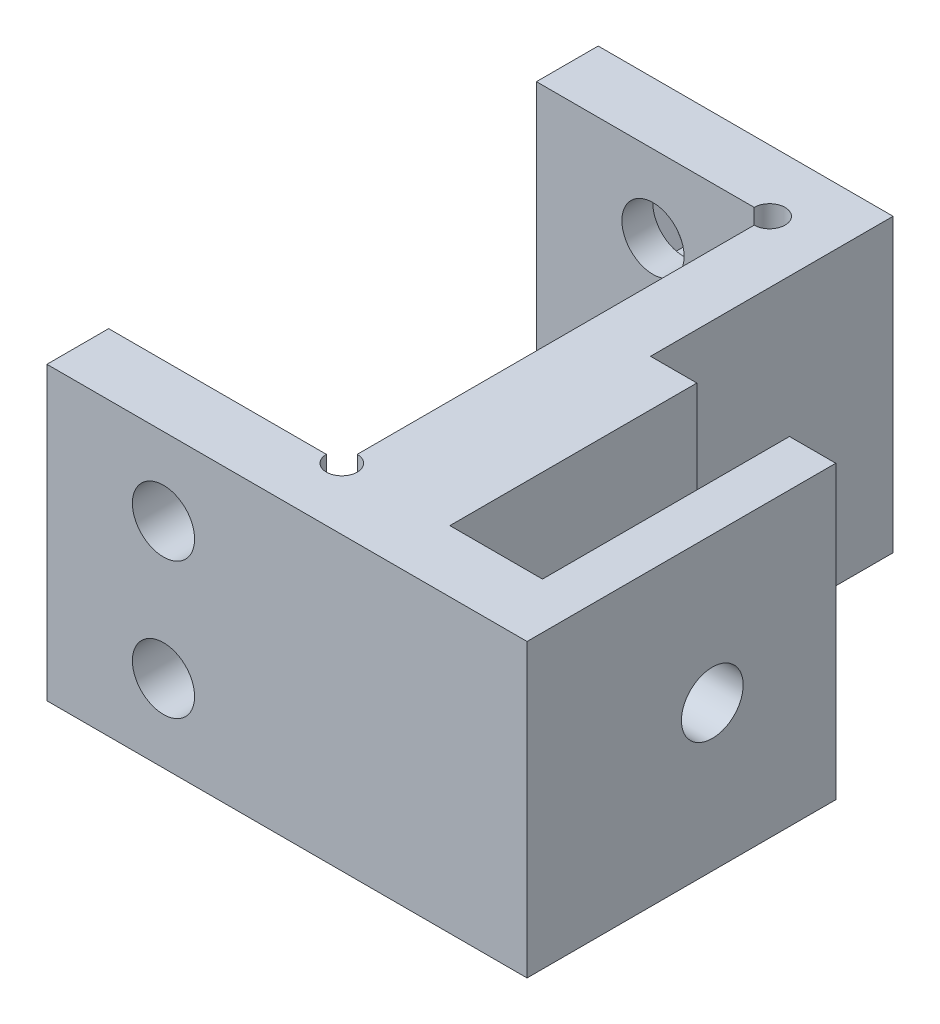
from build123d import *

# Parameters (mm, degrees)
SKETCH1_W               = 11.9888
SKETCH1_H               = 14.986
BOSS_EXTRUDE1_DEPTH     = 3.175
SKETCH6_W               = 25.1714
SKETCH6_H               = 14.986
BOSS_EXTRUDE6_DEPTH     = 3.175
SKETCH10_W              = 24.6888
SKETCH10_H              = 14.986
BOSS_EXTRUDE7_DEPTH     = 3.175
M3_CLEARANCE_HOLE1_D    = 3.2
SKETCH15_R              = 0.79375
CUT_EXTRUDE5_DEPTH      = 41.467708539
CUT_EXTRUDE6_DEPTH      = 1.5875
SKETCH17_W              = 9.525
SKETCH17_H              = 14.986
BOSS_EXTRUDE8_DEPTH     = 12.7
CUT_EXTRUDE7_DEPTH      = 2.38125
CUT_EXTRUDE7_DEPTH_BACK = 2.38125
SKETCH19_W              = 12.7
SKETCH19_H              = 14.986
SKETCH20_R              = 1.5875
CUT_EXTRUDE8_DEPTH      = 16.60525
CUT_EXTRUDE9_DEPTH      = 3.39725


with BuildPart() as part:
    # Sketch1 → Boss-Extrude1 (new body)
    with BuildSketch(Plane.XY):
        with Locations((5.9944, 7.493)):
            Rectangle(SKETCH1_W, SKETCH1_H)
    extrude(amount=BOSS_EXTRUDE1_DEPTH)

    # Sketch6 → Boss-Extrude6 (add)
    with BuildSketch(Plane(origin=(11.9888, 0, 0), x_dir=(0, 0, -1), z_dir=(1, 0, 0))):
        with Locations((-12.5857, 7.493)):
            Rectangle(SKETCH6_W, SKETCH6_H)
    extrude(amount=BOSS_EXTRUDE6_DEPTH)

    # Sketch10 → Boss-Extrude7 (add)
    with BuildSketch(Plane.XY.offset(25.1714)):
        with Locations((12.3444, 7.493)):
            Rectangle(SKETCH10_W, SKETCH10_H)
    extrude(amount=BOSS_EXTRUDE7_DEPTH)

    # M3 Clearance Hole1 (through all)
    with Locations(Plane(origin=(-0.089803774, -1.114373232, 0), x_dir=(1, 0, 0), z_dir=(0, 0, -1))):
        with Locations((6.084203774, -12.112573232), (6.084203774, -5.102173232)):
            Hole(M3_CLEARANCE_HOLE1_D / 2)

    # Sketch15 → Cut-Extrude5 (cut, through all)
    with BuildSketch(Plane.XZ):
        with Locations((11.9888, 25.1714)):
            Circle(SKETCH15_R)
        with Locations((11.9888, 3.175)):
            Circle(SKETCH15_R)
    extrude(amount=-CUT_EXTRUDE5_DEPTH, mode=Mode.SUBTRACT)

    # Sketch16 → Cut-Extrude6 (cut)
    with BuildSketch(Plane(origin=(0, 0, 0), x_dir=(-1, 0, 0), z_dir=(0, 0, -1))):
        Polygon((-4.40668676, 6.7378), (-7.58211324, 6.7378), (-9.169826481, 3.9878), (-7.58211324, 1.2378), (-4.40668676, 1.2378), (-2.818973519, 3.9878), align=None)
        Polygon((-4.40668676, 13.7482), (-7.58211324, 13.7482), (-9.169826481, 10.9982), (-7.58211324, 8.2482), (-4.40668676, 8.2482), (-2.818973519, 10.9982), align=None)
    extrude(amount=-CUT_EXTRUDE6_DEPTH, mode=Mode.SUBTRACT)

    # Sketch17 → Boss-Extrude8 (add)
    with BuildSketch(Plane(origin=(0, 0, 25.1714), x_dir=(-1, 0, 0), z_dir=(0, 0, -1))):
        with Locations((-19.9263, 7.493)):
            Rectangle(SKETCH17_W, SKETCH17_H)
    extrude(amount=BOSS_EXTRUDE8_DEPTH)

    # Sketch19 → Cut-Extrude7 (cut, two sides: drawn at the far end of the back side and taken through both)
    with BuildSketch(Plane(origin=(19.9263, 0, 0), x_dir=(0, 0, -1), z_dir=(1, 0, 0)).offset(-CUT_EXTRUDE7_DEPTH_BACK)):
        with Locations((-18.8214, 7.493)):
            Rectangle(SKETCH19_W, SKETCH19_H)
    extrude(amount=CUT_EXTRUDE7_DEPTH + CUT_EXTRUDE7_DEPTH_BACK, mode=Mode.SUBTRACT)

    # Sketch20 → Cut-Extrude8 (cut)
    with BuildSketch(Plane(origin=(24.6888, 0, 0), x_dir=(0, 0, -1), z_dir=(1, 0, 0))):
        with Locations((-18.8214, 7.493)):
            Circle(SKETCH20_R)
    extrude(amount=-CUT_EXTRUDE8_DEPTH, mode=Mode.SUBTRACT)

    # Sketch21 → Cut-Extrude9 (cut)
    with BuildSketch(Plane.ZY.offset(-11.9888)):
        Polygon((22.487574209, 7.493), (20.654487105, 10.668), (16.988312895, 10.668), (15.155225791, 7.493), (16.988312895, 4.318), (20.654487105, 4.318), align=None)
    extrude(amount=-CUT_EXTRUDE9_DEPTH, mode=Mode.SUBTRACT)


solid = part.part
